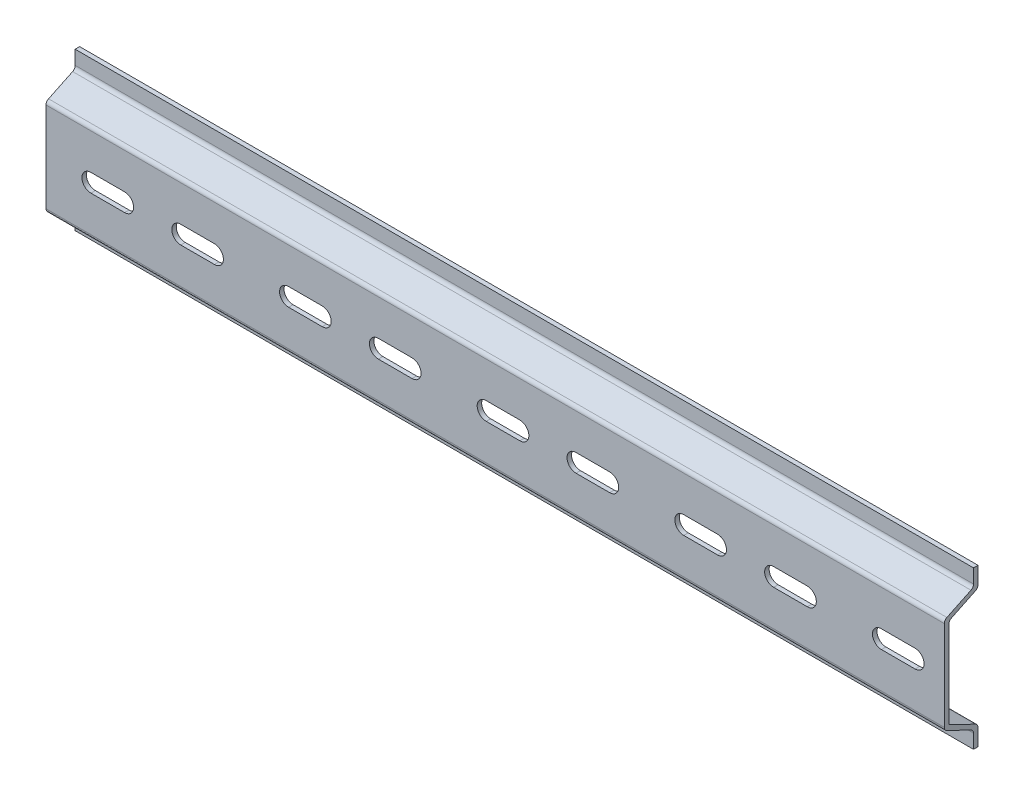
from build123d import *

# Parameters (mm, degrees)
EXTRUDE_1_DEPTH     = 200
FILLET_1_R          = 1
CUT_EXTRUDE_1_DEPTH = 10


with BuildPart() as part:
    # 草图1 → 凸台-拉伸1 (new body)
    with BuildSketch(Plane(origin=(0, 0, 0), x_dir=(0, 0, -1), z_dir=(1, 0, 0))):
        Polygon((0, -10), (0, 10), (6.5, 13.120839269), (6.5, 17.5), (5.5, 17.5), (5.5, 13.75), (-1, 10.629160731), (-1, -10.629160731), (5.5, -13.75), (5.5, -17.5), (6.5, -17.5), (6.5, -13.120839269), align=None)
    extrude(amount=EXTRUDE_1_DEPTH)

    # 圆角1
    fillet_1_edges = [part.edges().sort_by_distance(p)[0] for p in [
        (100, 10, 0),
        (100, -13.120839269, -6.5),
        (100, -13.75, -5.5),
        (100, -10.629160731, 1),
        (100, 10.629160731, 1),
        (100, 13.75, -5.5),
        (100, 13.120839269, -6.5),
    ]]
    fillet(fillet_1_edges, radius=FILLET_1_R)

    # 草图2 → 切除-拉伸1 (cut)
    with BuildSketch(Plane(origin=(0, 0, 0), x_dir=(-1, 0, 0), z_dir=(0, 0, -1))):
        with BuildLine():
            Line((-10, -2), (-17.5, -2))
            ThreePointArc((-17.5, -2), (-19.5, 0), (-17.5, 2))
            Line((-17.5, 2), (-10, 2))
            ThreePointArc((-10, 2), (-8, 0), (-10, -2))
        make_face()
        with BuildLine():
            Line((-30, -2), (-37.5, -2))
            ThreePointArc((-37.5, -2), (-39.5, 0), (-37.5, 2))
            Line((-37.5, 2), (-30, 2))
            ThreePointArc((-30, 2), (-28, 0), (-30, -2))
        make_face()
        with BuildLine():
            Line((-54, -2), (-61.5, -2))
            ThreePointArc((-61.5, -2), (-63.5, 0), (-61.5, 2))
            Line((-61.5, 2), (-54, 2))
            ThreePointArc((-54, 2), (-52, 0), (-54, -2))
        make_face()
        with BuildLine():
            Line((-74, -2), (-81.5, -2))
            ThreePointArc((-81.5, -2), (-83.5, 0), (-81.5, 2))
            Line((-81.5, 2), (-74, 2))
            ThreePointArc((-74, 2), (-72, 0), (-74, -2))
        make_face()
        with BuildLine():
            Line((-98, -2), (-105.5, -2))
            ThreePointArc((-105.5, -2), (-107.5, 0), (-105.5, 2))
            Line((-105.5, 2), (-98, 2))
            ThreePointArc((-98, 2), (-96, 0), (-98, -2))
        make_face()
        with BuildLine():
            Line((-118, -2), (-125.5, -2))
            ThreePointArc((-125.5, -2), (-127.5, 0), (-125.5, 2))
            Line((-125.5, 2), (-118, 2))
            ThreePointArc((-118, 2), (-116, 0), (-118, -2))
        make_face()
        with BuildLine():
            Line((-142, -2), (-149.5, -2))
            ThreePointArc((-149.5, -2), (-151.5, 0), (-149.5, 2))
            Line((-149.5, 2), (-142, 2))
            ThreePointArc((-142, 2), (-140, 0), (-142, -2))
        make_face()
        with BuildLine():
            Line((-162, -2), (-169.5, -2))
            ThreePointArc((-169.5, -2), (-171.5, 0), (-169.5, 2))
            Line((-169.5, 2), (-162, 2))
            ThreePointArc((-162, 2), (-160, 0), (-162, -2))
        make_face()
        with BuildLine():
            Line((-186, -2), (-193.5, -2))
            ThreePointArc((-193.5, -2), (-195.5, 0), (-193.5, 2))
            Line((-193.5, 2), (-186, 2))
            ThreePointArc((-186, 2), (-184, 0), (-186, -2))
        make_face()
        with BuildLine():
            Line((-206, -2), (-213.5, -2))
            ThreePointArc((-213.5, -2), (-215.5, 0), (-213.5, 2))
            Line((-213.5, 2), (-206, 2))
            ThreePointArc((-206, 2), (-204, 0), (-206, -2))
        make_face()
        with BuildLine():
            Line((-230, -2), (-237.5, -2))
            ThreePointArc((-237.5, -2), (-239.5, 0), (-237.5, 2))
            Line((-237.5, 2), (-230, 2))
            ThreePointArc((-230, 2), (-228, 0), (-230, -2))
        make_face()
        with BuildLine():
            Line((-250, -2), (-257.5, -2))
            ThreePointArc((-257.5, -2), (-259.5, 0), (-257.5, 2))
            Line((-257.5, 2), (-250, 2))
            ThreePointArc((-250, 2), (-248, 0), (-250, -2))
        make_face()
        with BuildLine():
            Line((-274, -2), (-281.5, -2))
            ThreePointArc((-281.5, -2), (-283.5, 0), (-281.5, 2))
            Line((-281.5, 2), (-274, 2))
            ThreePointArc((-274, 2), (-272, 0), (-274, -2))
        make_face()
        with BuildLine():
            Line((-294, -2), (-301.5, -2))
            ThreePointArc((-301.5, -2), (-303.5, 0), (-301.5, 2))
            Line((-301.5, 2), (-294, 2))
            ThreePointArc((-294, 2), (-292, 0), (-294, -2))
        make_face()
        with BuildLine():
            Line((-318, -2), (-325.5, -2))
            ThreePointArc((-325.5, -2), (-327.5, 0), (-325.5, 2))
            Line((-325.5, 2), (-318, 2))
            ThreePointArc((-318, 2), (-316, 0), (-318, -2))
        make_face()
        with BuildLine():
            Line((-338, -2), (-345.5, -2))
            ThreePointArc((-345.5, -2), (-347.5, 0), (-345.5, 2))
            Line((-345.5, 2), (-338, 2))
            ThreePointArc((-338, 2), (-336, 0), (-338, -2))
        make_face()
        with BuildLine():
            Line((-362, -2), (-369.5, -2))
            ThreePointArc((-369.5, -2), (-371.5, 0), (-369.5, 2))
            Line((-369.5, 2), (-362, 2))
            ThreePointArc((-362, 2), (-360, 0), (-362, -2))
        make_face()
        with BuildLine():
            Line((-382, -2), (-389.5, -2))
            ThreePointArc((-389.5, -2), (-391.5, 0), (-389.5, 2))
            Line((-389.5, 2), (-382, 2))
            ThreePointArc((-382, 2), (-380, 0), (-382, -2))
        make_face()
    extrude(amount=-CUT_EXTRUDE_1_DEPTH, mode=Mode.SUBTRACT)


solid = part.part
